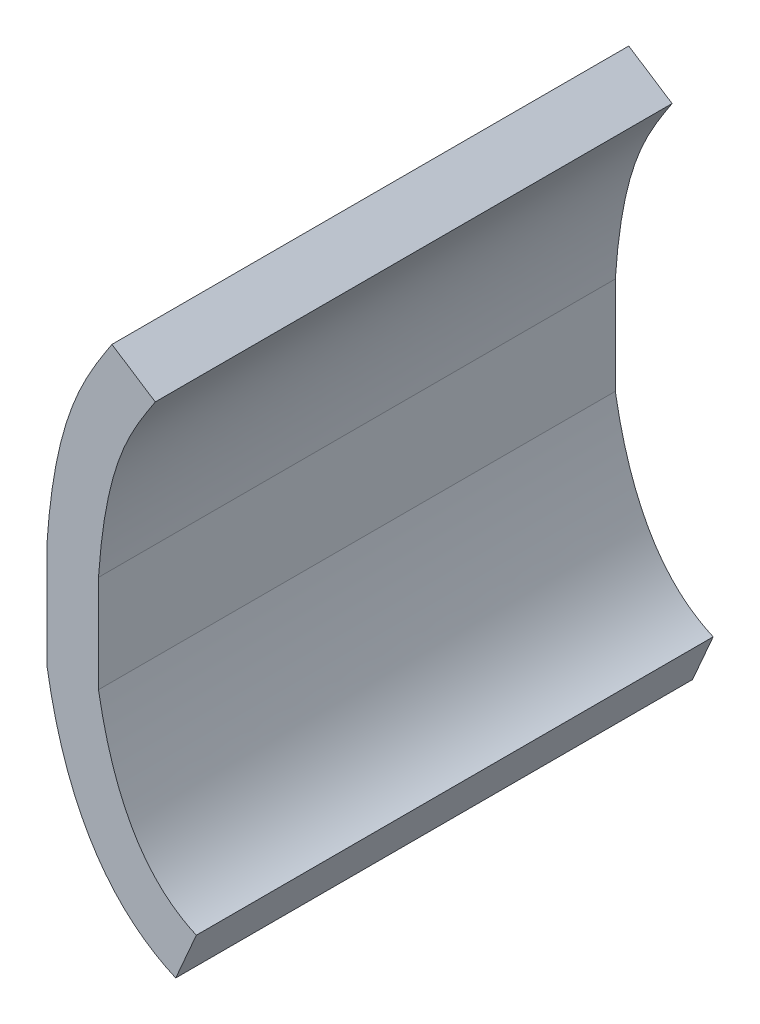
from build123d import *

# Parameters (mm, degrees)
BOSS_EXTRUDE1_DEPTH = 100


with BuildPart() as part:
    # Sketch2 → Boss-Extrude1 (new body)
    with BuildSketch(Plane.XY):
        with BuildLine():
            add(Edge.make_bspline(
                [(0, 10), (1.533515377, 33.319151282), (7.303166768, 41.847313143), (12.598069813, 50)],
                knots=[0, 0, 0, 0, 1, 1, 1, 1], degree=3))
            Line((0, 10), (0, 0))
            Line((0, 0), (0, -10))
            add(Edge.make_bspline(
                [(0, -10), (5.162408831, -41.387474282), (24.940857621, -50)],
                knots=[0, 0, 0, 1, 1, 1], degree=2))
            Line((24.940857621, -50), (28.933264328, -40.831538368))
            add(Edge.make_bspline(
                [(10, -9.163474156), (10.056385248, -9.489994067), (10.218691454, -10.40274145), (10.608632812, -12.423582905), (11.217159707, -15.147367418), (12.036197112, -18.205876092), (13.241421003, -22.010184853), (14.946624948, -26.249584187), (17.264049235, -30.529570228), (19.809393711, -34.048772515), (22.561889728, -36.886540275), (25.055614435, -38.769105307), (27.20346958, -40.024321521), (28.35268275, -40.578724115), (28.933264328, -40.831538368)],
                knots=[0.013914319, 0.013914319, 0.013914319, 0.013914319, 0.03125, 0.0625, 0.125, 0.1875, 0.25, 0.375, 0.5, 0.625, 0.75, 0.875, 0.9375, 1, 1, 1, 1], degree=3))
            Line((10, -9.163474156), (10, 0))
            Line((10, 0), (10, 9.66613227))
            add(Edge.make_bspline(
                [(10, 9.66613227), (10.044832415, 10.325668243), (10.145323413, 11.665207775), (10.370656318, 14.172612644), (10.703199446, 17.109625288), (11.171932341, 20.302311995), (11.878481202, 24.159772501), (12.891303178, 28.284538206), (14.25087497, 32.33124201), (15.719533079, 35.71915175), (17.301714969, 38.710204086), (18.75029356, 41.091588426), (19.993631129, 43.030159771), (20.657608588, 44.049863049), (20.984546989, 44.553257801)],
                knots=[0.004937345, 0.004937345, 0.004937345, 0.004937345, 0.036033053, 0.067128761, 0.129320177, 0.191511593, 0.253703009, 0.378085841, 0.502468673, 0.626851505, 0.751234336, 0.875617168, 0.937808584, 1, 1, 1, 1], degree=3))
            Line((20.984546989, 44.553257801), (12.598069813, 50))
        make_face()
    extrude(amount=BOSS_EXTRUDE1_DEPTH)


solid = part.part
